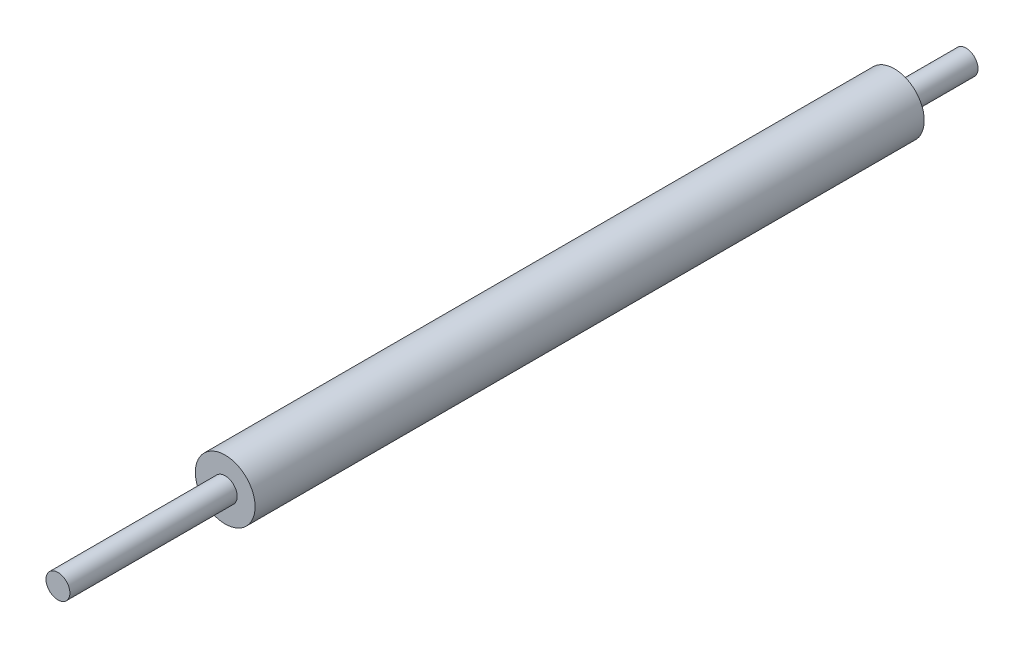
from build123d import *

# Parameters (mm, degrees)
SKETCH1_R           = 12.5
BOSS_EXTRUDE1_DEPTH = 280
SKETCH2_R           = 5
BOSS_EXTRUDE2_DEPTH = 70
BOSS_EXTRUDE3_START = 30
SKETCH3_R           = 5
BOSS_EXTRUDE3_DEPTH = 30


with BuildPart() as part:
    # Sketch1 → Boss-Extrude1 (new body)
    with BuildSketch(Plane.XY):
        Circle(SKETCH1_R)
    extrude(amount=BOSS_EXTRUDE1_DEPTH)

    # Sketch2 → Boss-Extrude2 (add)
    with BuildSketch(Plane.XY.offset(280)):
        Circle(SKETCH2_R)
    extrude(amount=BOSS_EXTRUDE2_DEPTH)

    # Sketch3 → Boss-Extrude3 (add)
    with BuildSketch(Plane(origin=(0, 0, 0), x_dir=(-1, 0, 0), z_dir=(0, 0, -1)).offset(BOSS_EXTRUDE3_START)):
        with Locations(Location((0, 0, 0), (0, 0, 180))):
            Circle(SKETCH3_R)
    extrude(amount=-BOSS_EXTRUDE3_DEPTH)


solid = part.part
